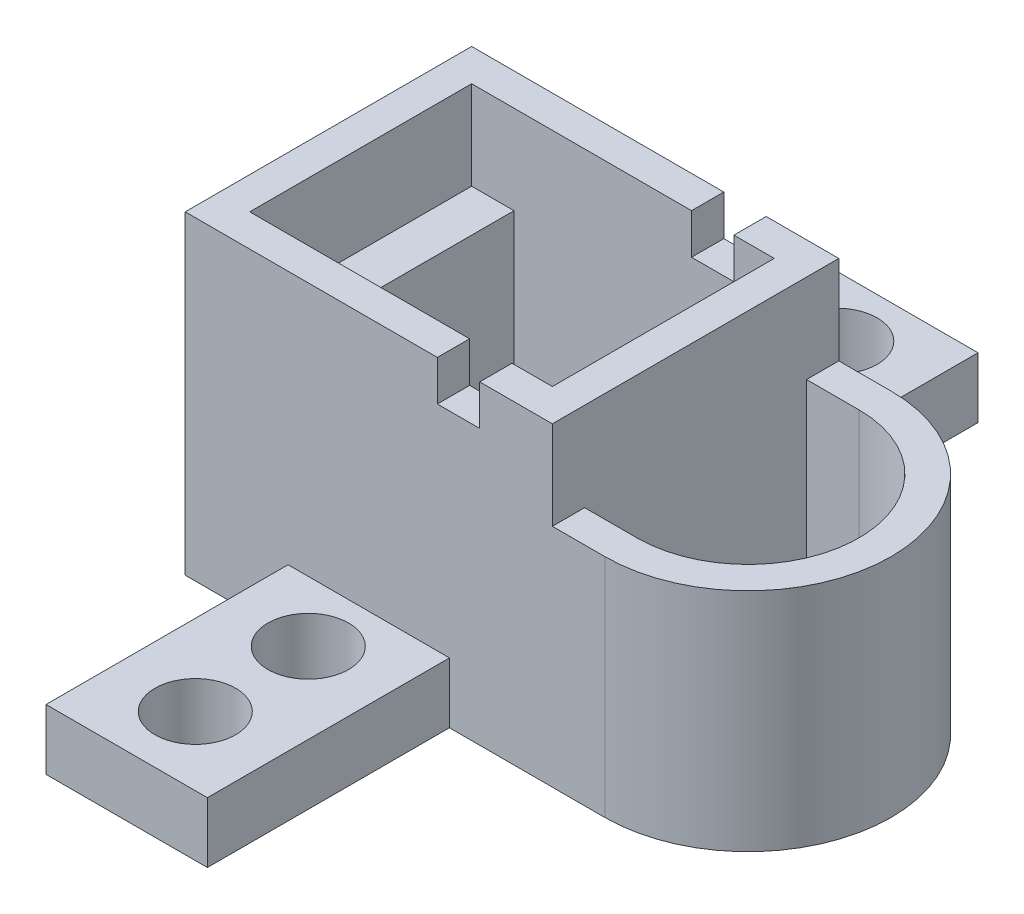
from build123d import *

# Parameters (mm, degrees)
EXTRUDE_1_DEPTH        = 7.2
SKETCH_1_3_W           = 1.05
SKETCH_1_3_H           = 5.5
EXTRUDE_2_DEPTH        = 5
SKETCH_1_4_W           = 9.1
SKETCH_1_4_H           = 7.1
EXTRUDE_3_DEPTH        = 0.6
EXTRUDE_4_DEPTH        = 5
EXTRUDE_START          = -0.6
EXTRUDE_5_DEPTH        = 0.6
SKETCH_2_W             = 1.05
SKETCH_2_H             = 1
CUT_EXTRUDE_1_DEPTH    = 7.1
SKETCH_4_W             = 4
SKETCH_4_H             = 1.5
EXTRUDE_7_DEPTH        = 6
SKETCH_5_R             = 1
CUT_EXTRUDE_2_DEPTH    = 1.5
PATTERN_LINEAR_2_COUNT = 2
PATTERN_LINEAR_2_PITCH = 13.1


with BuildPart() as part:
    # Эскиз1 → Бобышка-Вытянуть1 (new body)
    with BuildSketch(Plane(origin=(0, 0, 0), x_dir=(1, 0, 0), z_dir=(0, 1, 0))):
        Polygon((4.55, -2.75), (4.55, 2.75), (4.55, 3.55), (-4.55, 3.55), (-4.55, -3.55), (4.55, -3.55), align=None)
        Polygon((-2.7, -2.75), (-3.75, -2.75), (-3.75, 2.75), (-2.7, 2.75), (2.7, 2.75), (3.75, 2.75), (3.75, -2.75), (2.7, -2.75), align=None, mode=Mode.SUBTRACT)
    extrude(amount=EXTRUDE_1_DEPTH)

    # Эскиз1<3> → Бобышка-Вытянуть2 (add)
    with BuildSketch(Plane(origin=(0, 0, 0), x_dir=(1, 0, 0), z_dir=(0, 1, 0))):
        with Locations((-3.225, 0)):
            Rectangle(SKETCH_1_3_W, SKETCH_1_3_H)
        with Locations((3.225, 0)):
            Rectangle(SKETCH_1_3_W, SKETCH_1_3_H)
    extrude(amount=EXTRUDE_2_DEPTH)

    # Эскиз1<4> → Бобышка-Вытянуть3 (add)
    with BuildSketch(Plane(origin=(0, 0, 0), x_dir=(1, 0, 0), z_dir=(0, 1, 0))):
        Rectangle(SKETCH_1_4_W, SKETCH_1_4_H)
    extrude(amount=-EXTRUDE_3_DEPTH)

    # Эскиз1<5> → Бобышка-Вытянуть4 (add)
    with BuildSketch(Plane(origin=(0, 0, 0), x_dir=(1, 0, 0), z_dir=(0, 1, 0))):
        with BuildLine():
            Line((4.55, 3.55), (4.55, 2.75))
            Line((4.55, 2.75), (5.85, 2.75))
            ThreePointArc((5.85, 2.75), (8.6, 0), (5.85, -2.75))
            Line((5.85, -2.75), (4.55, -2.75))
            Line((4.55, -2.75), (4.55, -3.55))
            Line((4.55, -3.55), (5.85, -3.55))
            ThreePointArc((5.85, -3.55), (9.4, 0), (5.85, 3.55))
            Line((5.85, 3.55), (4.55, 3.55))
        make_face()
    extrude(amount=EXTRUDE_4_DEPTH)

    # Эскиз1<6> → Бобышка-Вытянуть5 (add)
    with BuildSketch(Plane(origin=(0, 0, 0), x_dir=(1, 0, 0), z_dir=(0, 1, 0)).offset(EXTRUDE_START)):
        with BuildLine():
            Line((4.55, 3.55), (4.55, -3.55))
            Line((4.55, -3.55), (5.85, -3.55))
            ThreePointArc((5.85, -3.55), (9.4, 0), (5.85, 3.55))
            Line((5.85, 3.55), (4.55, 3.55))
        make_face()
    extrude(amount=EXTRUDE_5_DEPTH)

    # Эскиз2 → Вырез-Вытянуть1 (cut)
    with BuildSketch(Plane(origin=(0, 0, -3.55), x_dir=(-1, 0, 0), z_dir=(0, 0, -1))):
        with Locations((-2.225, 6.7)):
            Rectangle(SKETCH_2_W, SKETCH_2_H)
    extrude(amount=-CUT_EXTRUDE_1_DEPTH, mode=Mode.SUBTRACT)

    # Эскиз4 → Бобышка-Вытянуть7 (add)
    with BuildSketch(Plane.XY.offset(3.55)):
        with Locations((0, 0.15)):
            Rectangle(SKETCH_4_W, SKETCH_4_H)
    extrude_7 = extrude(amount=EXTRUDE_7_DEPTH)

    # Эскиз5 → Вырез-Вытянуть2 (cut)
    with BuildSketch(Plane(origin=(0, 0.9, 0), x_dir=(1, 0, 0), z_dir=(0, 1, 0))):
        with Locations((0, -5.05)):
            Circle(SKETCH_5_R)
        with Locations((0, -7.85)):
            Circle(SKETCH_5_R)
    cut_extrude_2 = extrude(amount=-CUT_EXTRUDE_2_DEPTH, mode=Mode.SUBTRACT)

    # Линейный массив2: Бобышка-Вытянуть7, Вырез-Вытянуть2 ×2
    with Locations(*[(0, 0, -i * PATTERN_LINEAR_2_PITCH) for i in range(1, PATTERN_LINEAR_2_COUNT)]):
        add(extrude_7)
        add(cut_extrude_2, mode=Mode.SUBTRACT)


solid = part.part
